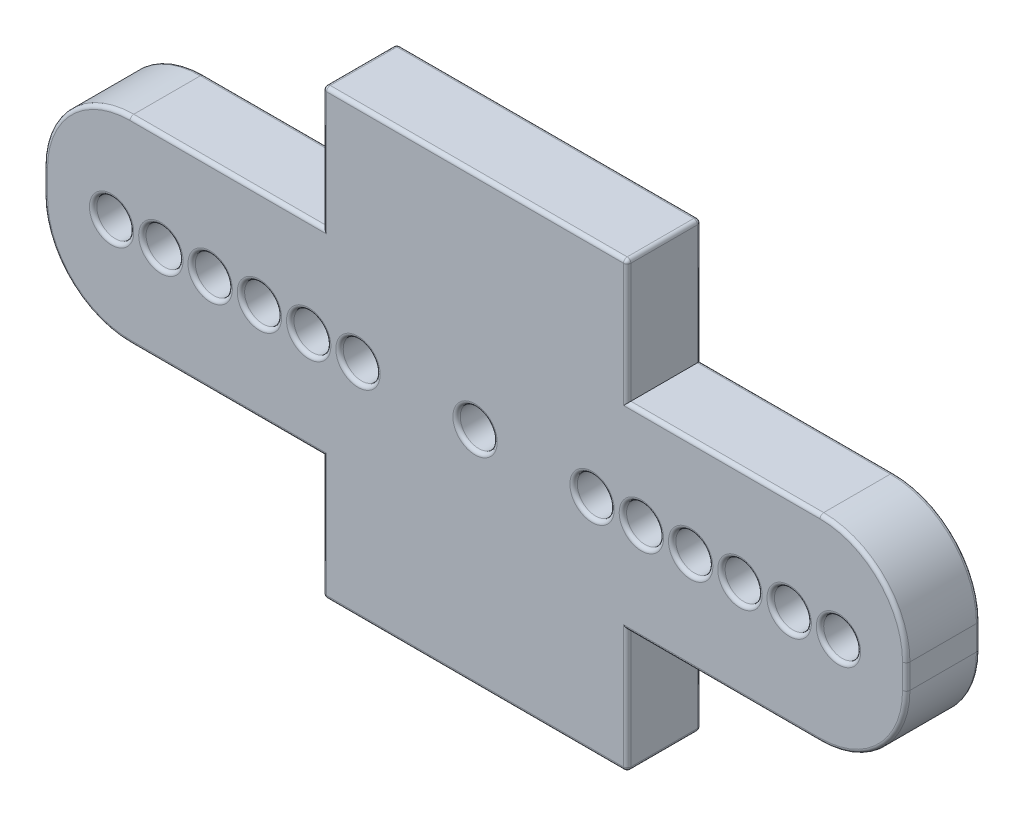
from build123d import *

# Parameters (mm, degrees)
SKETCH_1_R          = 0.75
EXTRUDE_1_DEPTH     = 1.5
SKETCH_2_R          = 0.75
CUT_EXTRUDE_1_DEPTH = 20.906029237
FILLET_1_R          = 0.15


with BuildPart() as part:
    # 草图1 → 凸台-拉伸1 (new, symmetric)
    with BuildSketch(Plane.XY):
        with BuildLine():
            Line((-17.5, -0.5), (-17.5, 0.5))
            ThreePointArc((-17.5, 0.5), (-16.474873734, 2.974873734), (-14, 4))
            Line((-14, 4), (-6.175, 4))
            Line((-6.175, 4), (-6.175, 9))
            Line((-6.175, 9), (6.175, 9))
            Line((6.175, 9), (6.175, 4))
            Line((6.175, 4), (14, 4))
            ThreePointArc((14, 4), (16.474873734, 2.974873734), (17.5, 0.5))
            Line((17.5, 0.5), (17.5, -0.5))
            ThreePointArc((17.5, -0.5), (16.474873734, -2.974873734), (14, -4))
            Line((14, -4), (6.175, -4))
            Line((6.175, -4), (6.175, -9))
            Line((6.175, -9), (-6.175, -9))
            Line((-6.175, -9), (-6.175, -4))
            Line((-6.175, -4), (-14, -4))
            ThreePointArc((-14, -4), (-16.474873734, -2.974873734), (-17.5, -0.5))
        make_face()
        Circle(SKETCH_1_R, mode=Mode.SUBTRACT)
    extrude(amount=EXTRUDE_1_DEPTH, both=True)

    # 草图2 → 切除-拉伸1 (cut, through all)
    with BuildSketch(Plane(origin=(0, 0, -1.5), x_dir=(-1, 0, 0), z_dir=(0, 0, -1))):
        with Locations((-14.75, 0)):
            Circle(SKETCH_2_R)
        with Locations((-12.75, 0)):
            Circle(SKETCH_2_R)
        with Locations((-10.75, 0)):
            Circle(SKETCH_2_R)
        with Locations((-8.75, 0)):
            Circle(SKETCH_2_R)
        with Locations((-6.75, 0)):
            Circle(SKETCH_2_R)
        with Locations((-4.75, 0)):
            Circle(SKETCH_2_R)
    cut_extrude_1 = extrude(amount=-CUT_EXTRUDE_1_DEPTH, mode=Mode.SUBTRACT)

    # 镜向1: 切除-拉伸1 across plane
    add(cut_extrude_1.mirror(Plane(origin=(0, 0, 0), x_dir=(0, 0, 1), z_dir=(1, 0, 0))), mode=Mode.SUBTRACT)

    # 圆角1
    fillet_1_edges = [part.edges().sort_by_distance(p)[0] for p in [
        (-10.0875, 4, 1.5),
        (6.175, 6.5, -1.5),
        (10.0875, 4, -1.5),
        (16.474873734, 2.974873734, -1.5),
        (-16.474873734, 2.974873734, 1.5),
        (17.5, 0, -1.5),
        (16.474873734, -2.974873734, -1.5),
        (10.0875, -4, -1.5),
        (6.175, -6.5, -1.5),
        (0, -9, -1.5),
        (-6.175, -6.5, -1.5),
        (-10.0875, -4, -1.5),
        (-16.474873734, -2.974873734, -1.5),
        (-17.5, 0, -1.5),
        (-16.474873734, 2.974873734, -1.5),
        (-17.5, 0, 1.5),
        (-10.0875, 4, -1.5),
        (-6.175, 6.5, -1.5),
        (0, 9, -1.5),
        (-16.474873734, -2.974873734, 1.5),
        (6.175, 9, 0),
        (6.175, -9, 0),
        (-6.175, -9, 0),
        (-6.175, 9, 0),
        (-10.0875, -4, 1.5),
        (-6.175, -6.5, 1.5),
        (0, -9, 1.5),
        (-0.75, 0, -1.5),
        (-0.75, 0, 1.5),
        (6.175, -6.5, 1.5),
        (10.0875, -4, 1.5),
        (16.474873734, -2.974873734, 1.5),
        (0, 9, 1.5),
        (17.5, 0, 1.5),
        (16.474873734, 2.974873734, 1.5),
        (15.5, 0, 1.5),
        (15.5, 0, -1.5),
        (13.5, 0, 1.5),
        (13.5, 0, -1.5),
        (10.0875, 4, 1.5),
        (11.5, 0, 1.5),
        (11.5, 0, -1.5),
        (9.5, 0, 1.5),
        (9.5, 0, -1.5),
        (6.175, 6.5, 1.5),
        (7.5, 0, 1.5),
        (7.5, 0, -1.5),
        (5.5, 0, 1.5),
        (5.5, 0, -1.5),
        (-15.5, 0, -1.5),
        (-15.5, 0, 1.5),
        (-13.5, 0, -1.5),
        (-13.5, 0, 1.5),
        (-11.5, 0, -1.5),
        (-11.5, 0, 1.5),
        (-9.5, 0, -1.5),
        (-9.5, 0, 1.5),
        (-6.175, 6.5, 1.5),
        (-7.5, 0, -1.5),
        (-7.5, 0, 1.5),
        (-5.5, 0, -1.5),
        (-5.5, 0, 1.5),
    ]]
    fillet(fillet_1_edges, radius=FILLET_1_R)


solid = part.part
